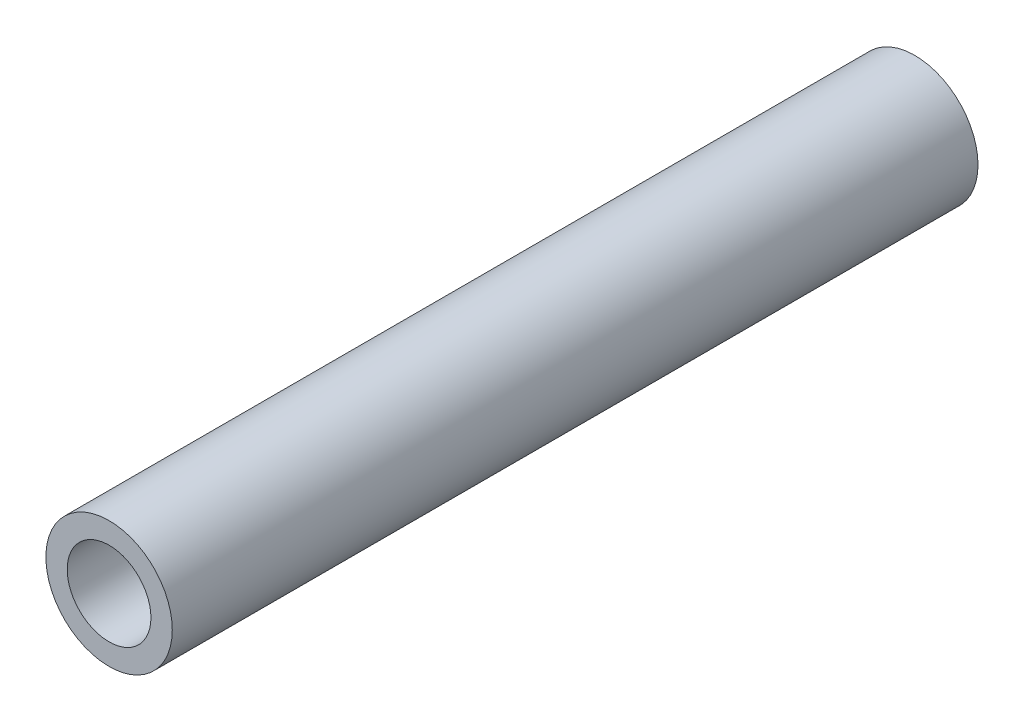
from build123d import *

# Parameters (mm, degrees)
SKETCH1_R      = 4
SKETCH1_R_2    = 2.65
EXTRUDE1_DEPTH = 25.5


with BuildPart() as part:
    # Sketch1 → Extrude1 (new, symmetric)
    with BuildSketch(Plane.XY):
        Circle(SKETCH1_R)
        Circle(SKETCH1_R_2, mode=Mode.SUBTRACT)
    extrude(amount=EXTRUDE1_DEPTH, both=True)


solid = part.part
